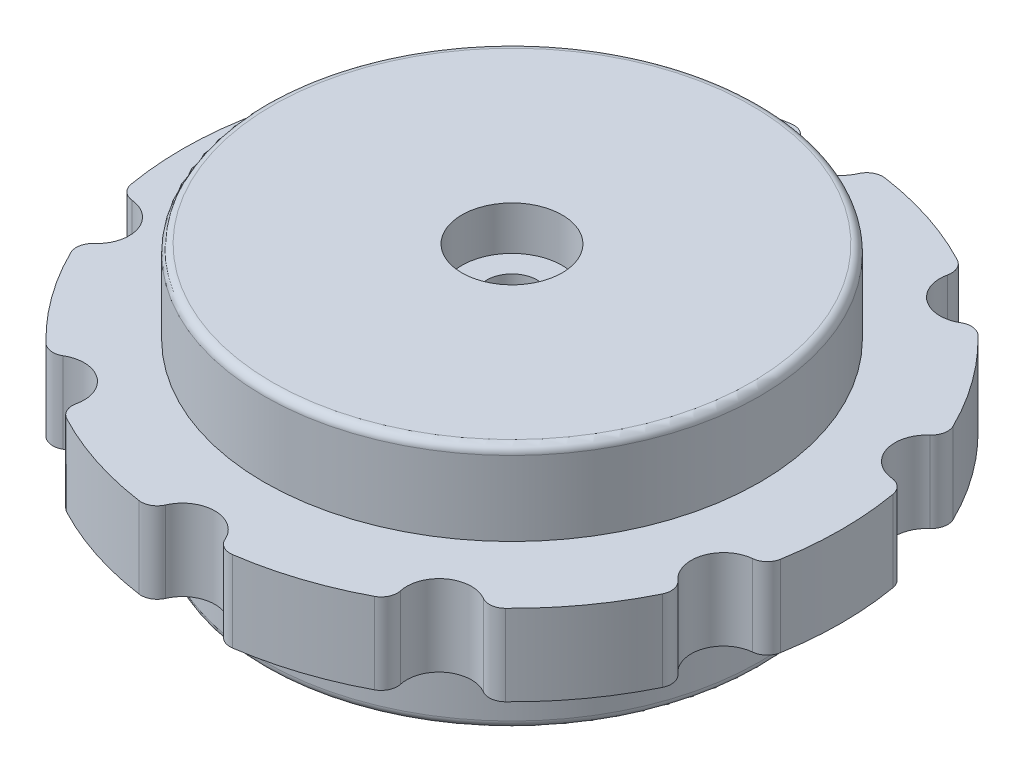
from build123d import *

# Parameters (mm, degrees)
SKETCH_1_R                       = 15.3
SKETCH_1_R_2                     = 13.7
EXTRUDE_1_DEPTH                  = 7.6
SKETCH_1_3_R                     = 20.35
EXTRUDE_2_DEPTH                  = 2.5
SKETCH_1_4_R                     = 2
CUT_EXTRUDE_1_DEPTH              = 30.765836121
FILLET_1_R                       = 1
PATTERN_CIRCULAR_1_COUNT         = 10
FILLET_1_OF_PATTERN_CIRCULAR_1_R = 1
FILLET_2_R                       = 0.5
SKETCH_1_5_R                     = 13.7
EXTRUDE_3_DEPTH                  = 3.9
EXTRUDE_START                    = -7.6
SKETCH_1_6_R                     = 13.7
EXTRUDE_5_DEPTH                  = 15.2
SKETCH_4_R                       = 1.55
CUT_EXTRUDE_3_DEPTH              = 33.42412133
SKETCH_4_3_R                     = 3.1
CUT_EXTRUDE_4_DEPTH              = 2.7
CUT_EXTRUDE_START                = -12.5
SKETCH_4_4_R                     = 3.1
CUT_EXTRUDE_5_DEPTH              = 2.7


with BuildPart() as part:
    # 草图1 → 凸台-拉伸1 (new, symmetric)
    with BuildSketch(Plane(origin=(0, 0, 0), x_dir=(1, 0, 0), z_dir=(0, 1, 0))):
        with Locations(Location((0, 0, 0), (0, 0, 90))):
            Circle(SKETCH_1_R)
        with Locations(Location((0, 0, 0), (0, 0, 90))):
            Circle(SKETCH_1_R_2, mode=Mode.SUBTRACT)
    extrude(amount=EXTRUDE_1_DEPTH, both=True)

    # 草图1<3> → 凸台-拉伸2 (add, symmetric)
    with BuildSketch(Plane(origin=(0, 0, 0), x_dir=(1, 0, 0), z_dir=(0, 1, 0))):
        with Locations(Location((0, 0, 0), (0, 0, 270))):
            Circle(SKETCH_1_3_R)
    extrude(amount=EXTRUDE_2_DEPTH, both=True)

    # 草图1<4> → 切除-拉伸1 (cut, symmetric)
    with BuildSketch(Plane(origin=(0, 0, 0), x_dir=(1, 0, 0), z_dir=(0, 1, 0))):
        with Locations((0, 20.35)):
            Circle(SKETCH_1_4_R)
    cut_extrude_1 = extrude(amount=CUT_EXTRUDE_1_DEPTH, both=True, mode=Mode.SUBTRACT)

    # 圆角1
    fillet_1_edges = [part.edges().sort_by_distance(p)[0] for p in [
        (-1.997583796, 0, -20.251719902),
        (1.997583796, 0, -20.251719902),
    ]]
    fillet(fillet_1_edges, radius=FILLET_1_R)

    # 阵列(圆周)1: 切除-拉伸1 ×10 about axis
    pattern_circular_1_axis = Axis((0, 0, 0), (0, 1, 0))
    for i in range(1, PATTERN_CIRCULAR_1_COUNT):
        add(cut_extrude_1.rotate(pattern_circular_1_axis, i * 360 / PATTERN_CIRCULAR_1_COUNT), mode=Mode.SUBTRACT)

    # 圆角1 of 阵列(圆周)1
    fillet_1_of_pattern_circular_1_edges = [part.edges().sort_by_distance(p)[0] for p in [
        (-13.51974153, 0, -15.20983527),
        (-10.287583053, 0, -17.558135861),
        (-19.877817519, 0, -4.358310529),
        (-18.643242838, 0, -8.157940701),
        (-18.643242838, 0, 8.157940701),
        (-19.877817519, 0, 4.358310529),
        (-10.287583053, 0, 17.558135861),
        (-13.51974153, 0, 15.20983527),
        (1.997583796, 0, 20.251719902),
        (-1.997583796, 0, 20.251719902),
        (13.51974153, 0, 15.20983527),
        (10.287583053, 0, 17.558135861),
        (19.877817519, 0, 4.358310529),
        (18.643242838, 0, 8.157940701),
        (18.643242838, 0, -8.157940701),
        (19.877817519, 0, -4.358310529),
        (10.287583053, 0, -17.558135861),
        (13.51974153, 0, -15.20983527),
    ]]
    fillet(fillet_1_of_pattern_circular_1_edges, radius=FILLET_1_OF_PATTERN_CIRCULAR_1_R)

    # 圆角2
    fillet_2_edges = [part.edges().sort_by_distance(p)[0] for p in [
        (0, -7.6, 15.3),
        (0, 7.6, 15.3),
    ]]
    fillet(fillet_2_edges, radius=FILLET_2_R)

    # 草图1<5> → 凸台-拉伸3 (add, symmetric)
    with BuildSketch(Plane(origin=(0, 0, 0), x_dir=(1, 0, 0), z_dir=(0, 1, 0))):
        with Locations(Location((0, 0, 0), (0, 0, 90))):
            Circle(SKETCH_1_5_R)
    extrude(amount=EXTRUDE_3_DEPTH, both=True)

    # 草图1<6> → 凸台-拉伸5 (add)
    with BuildSketch(Plane(origin=(0, 0, 0), x_dir=(1, 0, 0), z_dir=(0, 1, 0)).offset(EXTRUDE_START)):
        Circle(SKETCH_1_6_R)
    extrude(amount=EXTRUDE_5_DEPTH)

    # 草图4 → 切除-拉伸3 (cut, through all)
    with BuildSketch(Plane.XZ.offset(7.6)):
        with Locations(Location((0, 0, 0), (0, 0, 270))):
            Circle(SKETCH_4_R)
    extrude(amount=-CUT_EXTRUDE_3_DEPTH, mode=Mode.SUBTRACT)

    # 草图4<3> → 切除-拉伸4 (cut)
    with BuildSketch(Plane.XZ.offset(7.6)):
        with Locations(Location((0, 0, 0), (0, 0, 270))):
            Circle(SKETCH_4_3_R)
    extrude(amount=-CUT_EXTRUDE_4_DEPTH, mode=Mode.SUBTRACT)

    # 草图4<4> → 切除-拉伸5 (cut)
    with BuildSketch(Plane.XZ.offset(7.6).offset(CUT_EXTRUDE_START)):
        with Locations(Location((0, 0, 0), (0, 0, 270))):
            Circle(SKETCH_4_4_R)
    extrude(amount=-CUT_EXTRUDE_5_DEPTH, mode=Mode.SUBTRACT)


solid = part.part
